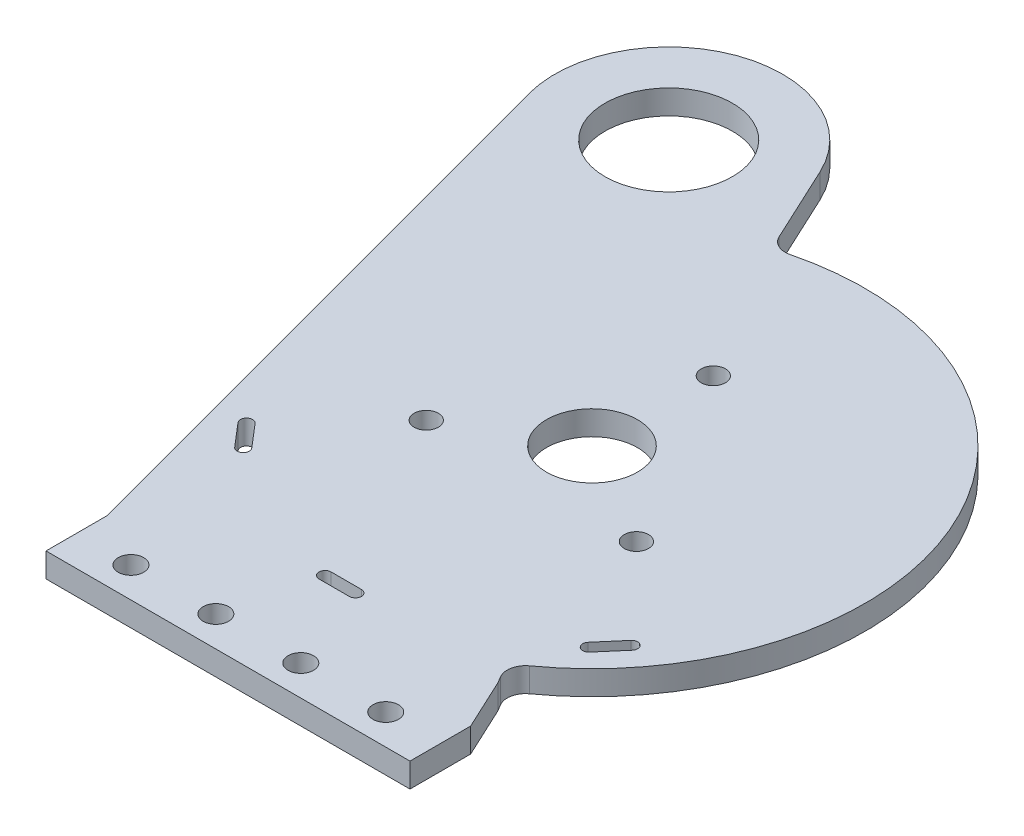
from build123d import *

# Parameters (mm, degrees)
SKETCH_1_R      = 10.5
SKETCH_1_R_2    = 7.5
SKETCH_1_R_3    = 2
SKETCH_1_R_4    = 2.1
EXTRUDE_1_DEPTH = 4


with BuildPart() as part:
    # 草图1 → 凸台-拉伸1 (new body)
    with BuildSketch(Plane(origin=(0, 0, 0), x_dir=(1, 0, 0), z_dir=(0, 1, 0))):
        with BuildLine():
            Line((0, 10), (0, 0))
            Line((0, 0), (60, 0))
            Line((60, 0), (60, 10))
            Line((60, 10), (56.095182285, 18.373908614))
            Line((56.095182285, 18.373908614), (55.431150168, 19.5))
            ThreePointArc((55.431150168, 19.5), (55.079606541, 21.641551662), (56.264363658, 23.459841248))
            ThreePointArc((56.264363658, 23.459841248), (70.812010618, 78.957314928), (19.020417199, 103.639990393))
            ThreePointArc((19.020417199, 103.639990393), (16.99979992, 103.840191523), (15.569521651, 105.281468301))
            Line((15.569521651, 105.281468301), (9.668235965, 117.936816295))
            ThreePointArc((9.668235965, 117.936816295), (-13.775496492, 127.647528231), (-25.492512153, 105.139350566))
            Line((-25.492512153, 105.139350566), (0, 10))
        make_face()
        with Locations(Location((-7.352321507, 110, 0), (0, 0, 270))):
            Circle(SKETCH_1_R, mode=Mode.SUBTRACT)
        with Locations(Location((30, 60, 0), (0, 0, 270))):
            Circle(SKETCH_1_R_2, mode=Mode.SUBTRACT)
        with Locations(Location((30, 80, 0), (0, 0, 270))):
            Circle(SKETCH_1_R_3, mode=Mode.SUBTRACT)
        with Locations(Location((47.320508076, 50, 0), (0, 0, 270))):
            Circle(SKETCH_1_R_3, mode=Mode.SUBTRACT)
        with Locations(Location((12.679491924, 50, 0), (0, 0, 270))):
            Circle(SKETCH_1_R_3, mode=Mode.SUBTRACT)
        with Locations(Location((23, 5, 0), (0, 0, 270))):
            Circle(SKETCH_1_R_4, mode=Mode.SUBTRACT)
        with Locations(Location((9, 5, 0), (0, 0, 270))):
            Circle(SKETCH_1_R_4, mode=Mode.SUBTRACT)
        with Locations(Location((37, 5, 0), (0, 0, 90))):
            Circle(SKETCH_1_R_4, mode=Mode.SUBTRACT)
        with Locations(Location((51, 5, 0), (0, 0, 90))):
            Circle(SKETCH_1_R_4, mode=Mode.SUBTRACT)
        with BuildLine():
            Line((26.5, 20.5), (31.5, 20.5))
            ThreePointArc((31.5, 20.5), (32.5, 19.5), (31.5, 18.5))
            Line((31.5, 18.5), (26.5, 18.5))
            ThreePointArc((26.5, 18.5), (25.5, 19.5), (26.5, 20.5))
        make_face(mode=Mode.SUBTRACT)
        with BuildLine():
            Line((-0.975772037, 35.443910191), (2.27680142, 31.646441837))
            ThreePointArc((2.27680142, 31.646441837), (2.167822441, 30.236433474), (0.757814079, 30.345412454))
            Line((0.757814079, 30.345412454), (-2.494759379, 34.142880808))
            ThreePointArc((-2.494759379, 34.142880808), (-2.3857804, 35.552889171), (-0.975772037, 35.443910191))
        make_face(mode=Mode.SUBTRACT)
        with BuildLine():
            Line((60.975772037, 35.443910191), (57.72319858, 31.646441837))
            ThreePointArc((57.72319858, 31.646441837), (57.832177559, 30.236433474), (59.242185921, 30.345412454))
            Line((59.242185921, 30.345412454), (62.494759379, 34.142880808))
            ThreePointArc((62.494759379, 34.142880808), (62.3857804, 35.552889171), (60.975772037, 35.443910191))
        make_face(mode=Mode.SUBTRACT)
    extrude(amount=EXTRUDE_1_DEPTH)


solid = part.part
